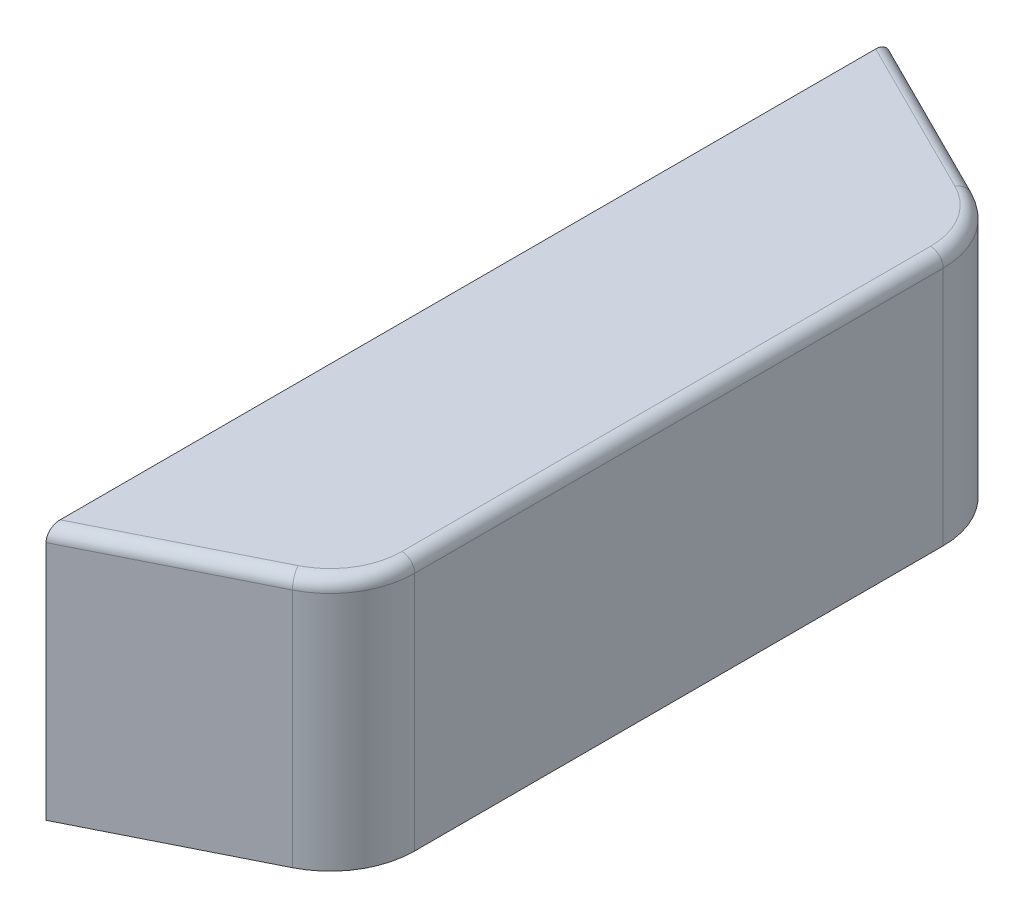
from build123d import *

# Parameters (mm, degrees)
BOSS_EXTRUDE1_DEPTH = 30
SHELL1_T            = -1.5
FILLET1_R           = 2
FILLET2_R           = 1.5


with BuildPart() as part:
    # Sketch1 → Boss-Extrude1 (new body)
    with BuildSketch(Plane(origin=(0, 0, 0), x_dir=(1, 0, 0), z_dir=(0, 1, 0))):
        with BuildLine():
            Line((0, -50), (0, 50))
            Line((0, 50), (19.472135955, 40.263932023))
            ThreePointArc((19.472135955, 40.263932023), (23.506508084, 36.576971234), (25, 31.319660113))
            Line((25, 31.319660113), (25, -31.319660113))
            ThreePointArc((25, -31.319660113), (23.506508084, -36.576971234), (19.472135955, -40.263932023))
            Line((19.472135955, -40.263932023), (0, -50))
        make_face()
    extrude(amount=BOSS_EXTRUDE1_DEPTH)

    # Shell1
    shell1_openings = [part.faces().sort_by_distance(p)[0] for p in [
        (11.834043947, 0, 0),
    ]]
    offset(amount=SHELL1_T, openings=shell1_openings, kind=Kind.INTERSECTION)

    # Fillet1
    fillet1_edges = [part.edges().sort_by_distance(p)[0] for p in [
        (1.5, 14.25, -47.572949017),
        (1.5, 14.25, 47.572949017),
        (10.150657781, 28.5, -43.247620126),
        (1.5, 28.5, 0),
        (10.150657781, 28.5, 43.247620126),
        (22.230531871, 28.5, 35.788374566),
        (23.5, 28.5, 0),
        (22.230531871, 28.5, -35.788374566),
    ]]
    fillet(fillet1_edges, radius=FILLET1_R)

    # Fillet2
    fillet2_edges = [part.edges().sort_by_distance(p)[0] for p in [
        (9.736067977, 30, 45.131966011),
        (23.506508084, 30, 36.576971234),
        (25, 30, 0),
        (23.506508084, 30, -36.576971234),
        (9.736067977, 30, -45.131966011),
    ]]
    fillet(fillet2_edges, radius=FILLET2_R)


solid = part.part
